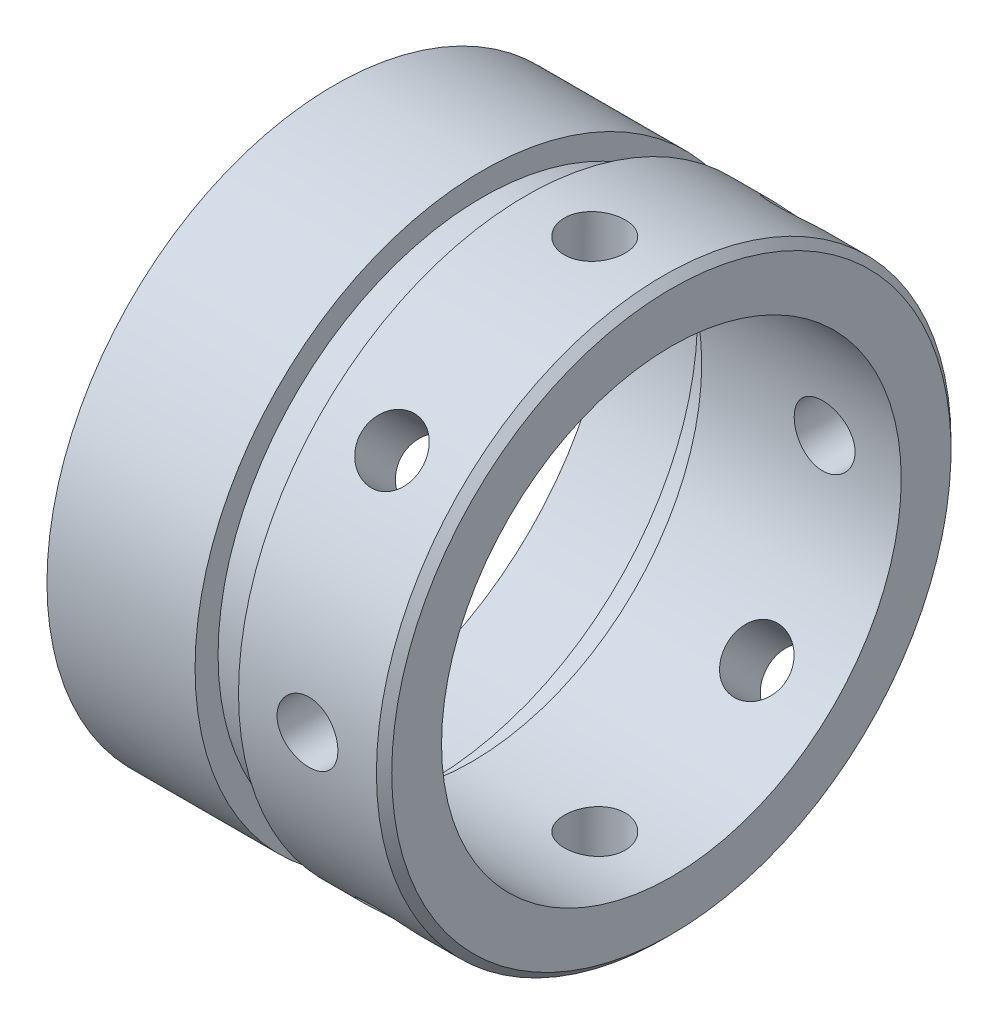
from build123d import *

# Parameters (mm, degrees)
SKETCH4_W         = 5.0419
SKETCH4_H         = 47.625
CIRPATTERN1_COUNT = 8


with BuildPart() as part:
    # Sketch1 → Revolve1 (revolve)
    with BuildSketch(Plane.XY, mode=Mode.PRIVATE) as revolve1_sk:
        with BuildLine():
            Line((0, 45.9613), (15.6972, 45.9613))
            Line((15.6972, 45.9613), (15.6972, 44.508928))
            Line((15.6972, 44.508928), (20.08759, 44.508928))
            ThreePointArc((20.08759, 44.508928), (20.518642294, 44.330380294), (20.69719, 43.899328))
            Line((20.69719, 43.899328), (20.69719, 41.783))
            Line((20.69719, 41.783), (22.8092, 41.783))
            Line((22.8092, 41.783), (22.8092, 38.1))
            Line((22.8092, 38.1), (55.88, 38.1))
            Line((55.88, 38.1), (55.88, 46.355))
            Line((55.88, 46.355), (54.61, 47.625))
            Line((54.61, 47.625), (31.75, 47.625))
            Line((31.75, 47.625), (31.75, 43.815))
            Line((31.75, 43.815), (24.5491, 43.815))
            Line((24.5491, 43.815), (24.5491, 47.625))
            Line((24.5491, 47.625), (0, 47.625))
            Line((0, 47.625), (0, 45.9613))
        make_face()
    revolve(revolve1_sk.sketch.rotate(Axis((0, 0, 0), (1, 0, 0)), 90), axis=Axis((0, 0, 0), (1, 0, 0)))

    # Sketch4 → Tap Drill for 3/8 Helicoil1 (revolve, cut)
    with BuildSketch(Plane.YZ.offset(43.18)):
        with Locations((2.52095, 23.8125)):
            Rectangle(SKETCH4_W, SKETCH4_H)
    tap_drill_for_3_8_helicoil1 = revolve(axis=Axis((43.18, 0, -6.35), (0, 0, 1)), mode=Mode.SUBTRACT)

    # CirPattern1: Tap Drill for 3/8 Helicoil1 ×8 about axis
    cirpattern1_axis = Axis((54.61, 0, 0), (-1, 0, 0))
    for i in range(1, CIRPATTERN1_COUNT):
        add(tap_drill_for_3_8_helicoil1.rotate(cirpattern1_axis, i * 360 / CIRPATTERN1_COUNT), mode=Mode.SUBTRACT)


solid = part.part
